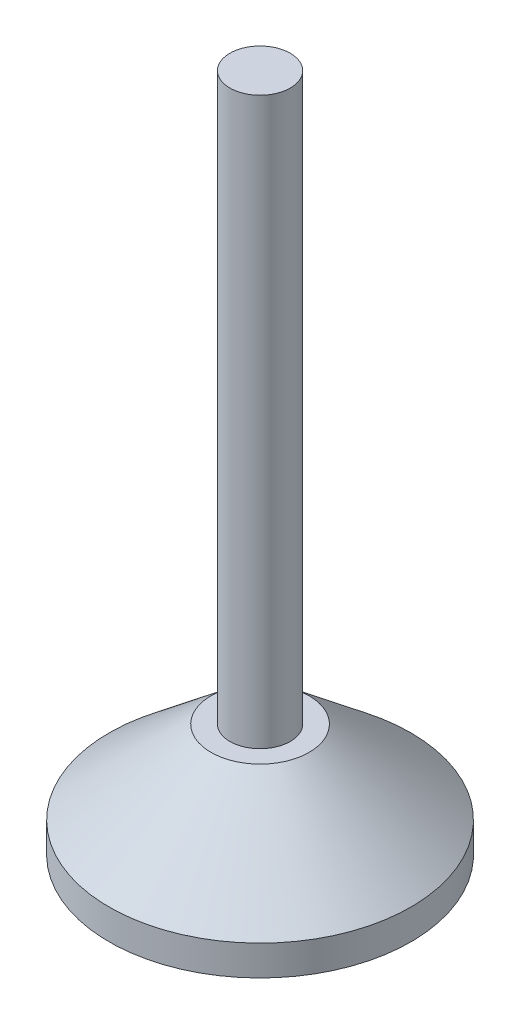
from build123d import *


with BuildPart() as part:
    # 草图1 → 旋转1 (revolve)
    with BuildSketch(Plane.XY, mode=Mode.PRIVATE) as revolve_1_sk:
        Polygon((0, 0), (0, 180), (8, 180), (8, 30), (13, 30), (40, 8), (40, 0), align=None)
    revolve(revolve_1_sk.sketch.rotate(Axis((0, 0, 0), (0, 1, 0)), 90), axis=Axis((0, 0, 0), (0, 1, 0)))


solid = part.part
